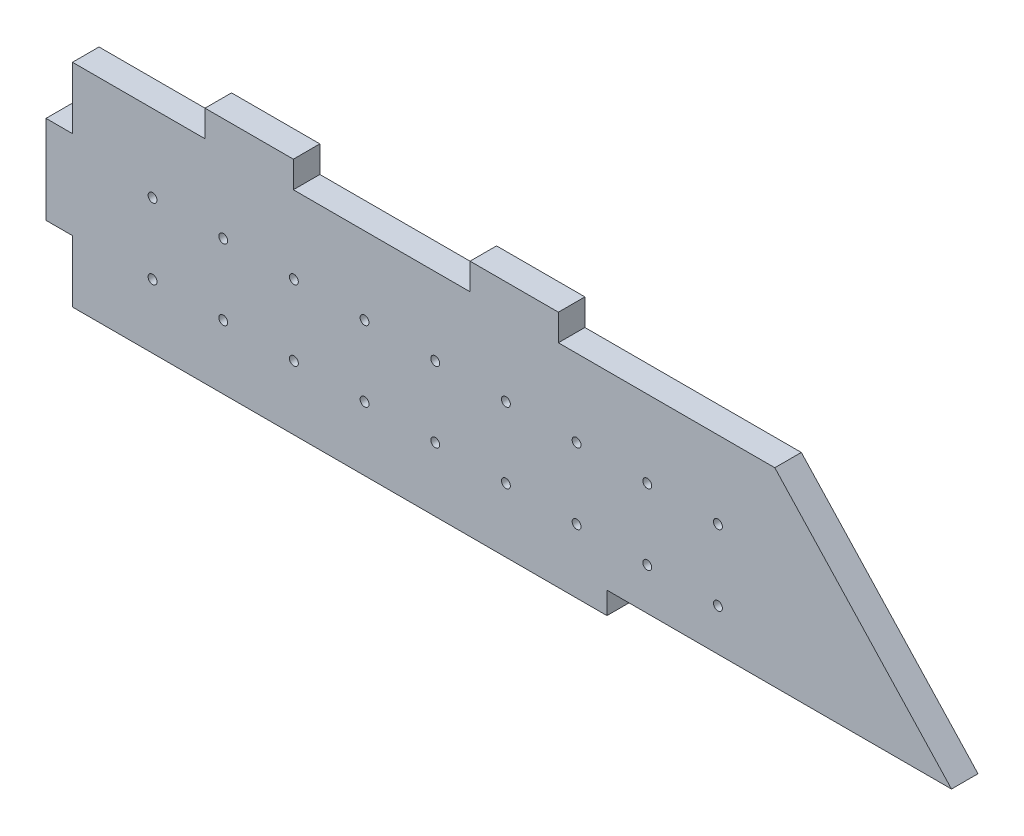
from build123d import *

# Parameters (mm, degrees)
ESQUISSE1_W             = 199
ESQUISSE1_H             = 48
BOSS_EXTRU_1_DEPTH      = 6
ESQUISSE2_W             = 20
ESQUISSE2_H             = 6
BOSS_EXTRU_2_DEPTH      = 6
ESQUISSE3_W             = 6
ESQUISSE3_H             = 20
BOSS_EXTRU_3_DEPTH      = 6
ESQUISSE4_W             = 78
ESQUISSE4_H             = 5
ENL_V_MAT_EXTRU_1_DEPTH = 213.077815907
ENL_V_MAT_EXTRU_2_DEPTH = 213.077815907
ESQUISSE6_R             = 1.005
ENL_V_MAT_EXTRU_3_DEPTH = 213.077815907
ESQUISSE7_R             = 2
ENL_V_MAT_EXTRU_4_DEPTH = 3


with BuildPart() as part:
    # Esquisse1 → Boss.-Extru.1 (new body)
    with BuildSketch(Plane.XY):
        with Locations((-99.5, 24)):
            Rectangle(ESQUISSE1_W, ESQUISSE1_H)
    extrude(amount=BOSS_EXTRU_1_DEPTH)

    # Esquisse2 → Boss.-Extru.2 (add)
    with BuildSketch(Plane(origin=(0, 48, 0), x_dir=(1, 0, 0), z_dir=(0, 1, 0))):
        with Locations((-99, -3)):
            Rectangle(ESQUISSE2_W, ESQUISSE2_H)
        with Locations((-159, -3)):
            Rectangle(ESQUISSE2_W, ESQUISSE2_H)
    extrude(amount=BOSS_EXTRU_2_DEPTH)

    # Esquisse3 → Boss.-Extru.3 (add)
    with BuildSketch(Plane.ZY.offset(199)):
        with Locations((3, 24)):
            Rectangle(ESQUISSE3_W, ESQUISSE3_H)
    extrude(amount=BOSS_EXTRU_3_DEPTH)

    # Esquisse4 → Enlèv. mat.-Extru.1 (cut, through all)
    with BuildSketch(Plane.XY.offset(6)):
        with Locations((-39, 2.5)):
            Rectangle(ESQUISSE4_W, ESQUISSE4_H)
    extrude(amount=-ENL_V_MAT_EXTRU_1_DEPTH, mode=Mode.SUBTRACT)

    # Esquisse5 → Enlèv. mat.-Extru.2 (cut, through all)
    with BuildSketch(Plane.XY.offset(6)):
        Polygon((0, 48), (-40, 48), (0, 5), align=None)
    extrude(amount=-ENL_V_MAT_EXTRU_2_DEPTH, mode=Mode.SUBTRACT)

    # Esquisse6 → Enlèv. mat.-Extru.3 (cut, through all)
    with BuildSketch(Plane.XY.offset(6)):
        with Locations((-148.88, 14.5)):
            Circle(ESQUISSE6_R)
        with Locations((-148.88, 30.5)):
            Circle(ESQUISSE6_R)
        with Locations((-132.88, 14.5)):
            Circle(ESQUISSE6_R)
        with Locations((-132.88, 30.5)):
            Circle(ESQUISSE6_R)
        with Locations((-116.88, 14.5)):
            Circle(ESQUISSE6_R)
        with Locations((-116.88, 30.5)):
            Circle(ESQUISSE6_R)
        with Locations((-100.88, 14.5)):
            Circle(ESQUISSE6_R)
        with Locations((-100.88, 30.5)):
            Circle(ESQUISSE6_R)
        with Locations((-84.88, 14.5)):
            Circle(ESQUISSE6_R)
        with Locations((-84.88, 30.5)):
            Circle(ESQUISSE6_R)
        with Locations((-68.88, 14.5)):
            Circle(ESQUISSE6_R)
        with Locations((-68.88, 30.5)):
            Circle(ESQUISSE6_R)
        with Locations((-52.88, 14.5)):
            Circle(ESQUISSE6_R)
        with Locations((-52.88, 30.5)):
            Circle(ESQUISSE6_R)
        with Locations((-164.88, 14.5)):
            Circle(ESQUISSE6_R)
        with Locations((-164.88, 30.5)):
            Circle(ESQUISSE6_R)
        with Locations((-180.88, 14.5)):
            Circle(ESQUISSE6_R)
        with Locations((-180.88, 30.5)):
            Circle(ESQUISSE6_R)
    extrude(amount=-ENL_V_MAT_EXTRU_3_DEPTH, mode=Mode.SUBTRACT)

    # Esquisse7 → Enlèv. mat.-Extru.4 (cut)
    with BuildSketch(Plane(origin=(0, 0, 0), x_dir=(-1, 0, 0), z_dir=(0, 0, -1))):
        with Locations((180.88, 14.5)):
            Circle(ESQUISSE7_R)
        with Locations((180.88, 30.5)):
            Circle(ESQUISSE7_R)
        with Locations((164.88, 14.5)):
            Circle(ESQUISSE7_R)
        with Locations((164.88, 30.5)):
            Circle(ESQUISSE7_R)
        with Locations((148.88, 14.5)):
            Circle(ESQUISSE7_R)
        with Locations((148.88, 30.5)):
            Circle(ESQUISSE7_R)
        with Locations((132.88, 14.5)):
            Circle(ESQUISSE7_R)
        with Locations((132.88, 30.5)):
            Circle(ESQUISSE7_R)
        with Locations((116.88, 14.5)):
            Circle(ESQUISSE7_R)
        with Locations((116.88, 30.5)):
            Circle(ESQUISSE7_R)
        with Locations((100.88, 14.5)):
            Circle(ESQUISSE7_R)
        with Locations((100.88, 30.5)):
            Circle(ESQUISSE7_R)
        with Locations((84.88, 14.5)):
            Circle(ESQUISSE7_R)
        with Locations((84.88, 30.5)):
            Circle(ESQUISSE7_R)
        with Locations((68.88, 14.5)):
            Circle(ESQUISSE7_R)
        with Locations((68.88, 30.5)):
            Circle(ESQUISSE7_R)
        with Locations((52.88, 14.5)):
            Circle(ESQUISSE7_R)
        with Locations((52.88, 30.5)):
            Circle(ESQUISSE7_R)
    extrude(amount=-ENL_V_MAT_EXTRU_4_DEPTH, mode=Mode.SUBTRACT)


solid = part.part
